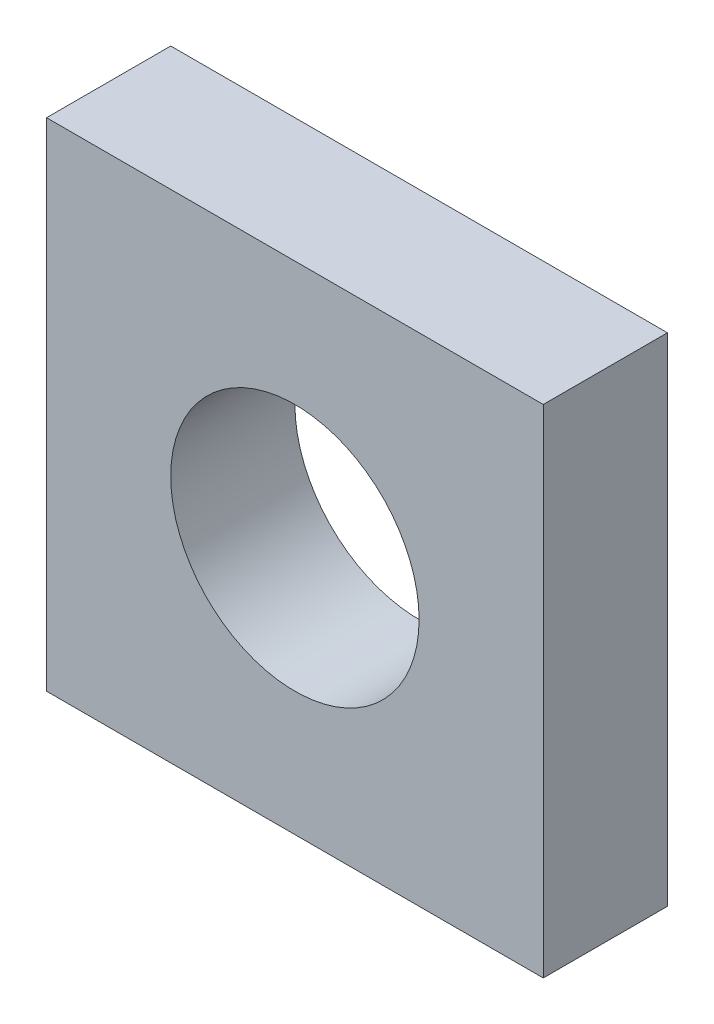
from build123d import *

# Parameters (mm, degrees)
SKETCH_1_W      = 40
SKETCH_1_H      = 40
SKETCH_1_R      = 10
EXTRUDE_1_DEPTH = 10


with BuildPart() as part:
    # 스케치1 → 보스-돌출1 (new body)
    with BuildSketch(Plane.XY):
        Rectangle(SKETCH_1_W, SKETCH_1_H)
        Circle(SKETCH_1_R, mode=Mode.SUBTRACT)
    extrude(amount=EXTRUDE_1_DEPTH)


solid = part.part
